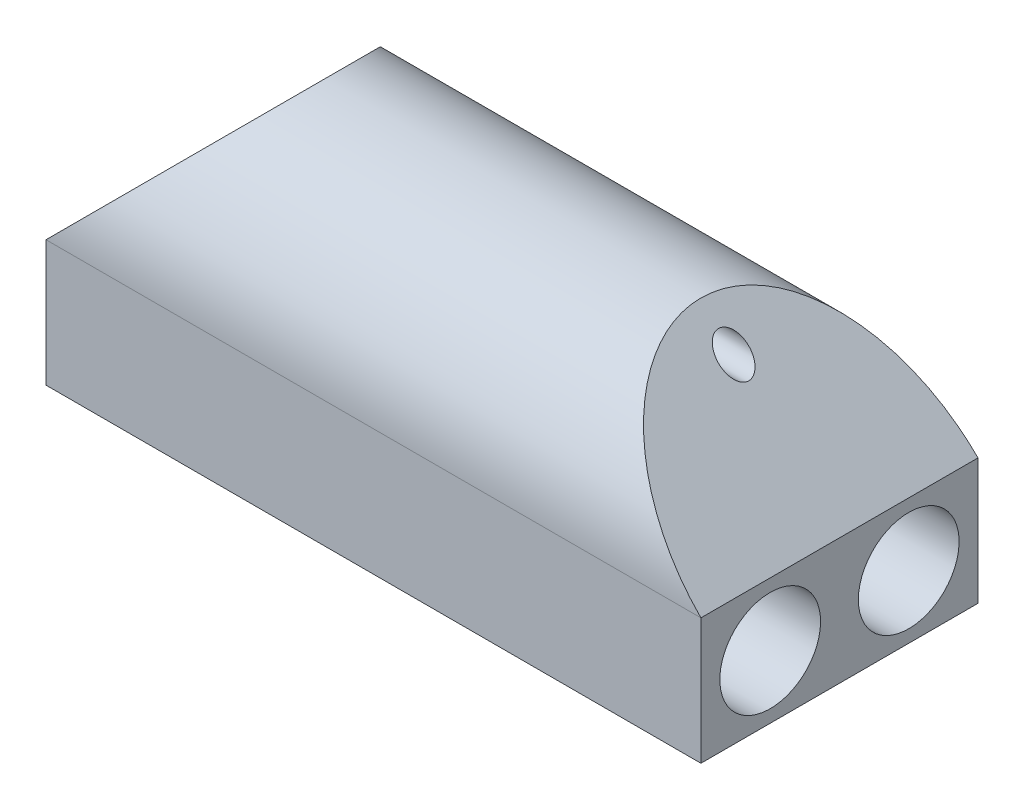
from build123d import *

# Parameters (mm, degrees)
SKETCH1_W              = 33.02
SKETCH1_H              = 13.97
DEPTH_A_DEPTH          = 6.35
ROUND_EXTRUDE_DEPTH    = 33.02
ANGLE_CUT_DEPTH        = 39.253150524
STRING_HOLE_R          = 0.762
STRING_HOLE_CUT_DEPTH  = 39.253150524
ELASTIC_HOLES_R        = 2.54
ELASTIC_HOLE_CUT_DEPTH = 39.253150524


with BuildPart() as part:
    # Sketch1 → depth a (new body)
    with BuildSketch(Plane(origin=(0, 0, 0), x_dir=(1, 0, 0), z_dir=(0, 1, 0))):
        with Locations((-16.51, 6.985)):
            Rectangle(SKETCH1_W, SKETCH1_H)
    extrude(amount=DEPTH_A_DEPTH)

    # Sketch4 → round extrude (add)
    with BuildSketch(Plane(origin=(0, 0, 0), x_dir=(0, 0, -1), z_dir=(1, 0, 0))):
        with BuildLine():
            Line((0, 6.35), (13.97, 6.35))
            ThreePointArc((13.97, 6.35), (6.985, 13.335), (0, 6.35))
        make_face()
    extrude(amount=-ROUND_EXTRUDE_DEPTH)

    # Sketch5 → angle cut (cut, through all)
    with BuildSketch(Plane.XY):
        Polygon((0, 6.35), (0, 13.335), (-6.985, 13.335), align=None)
        Polygon((-33.02, 6.35), (-33.02, 13.335), (-26.035, 13.335), align=None)
    extrude(amount=-ANGLE_CUT_DEPTH, mode=Mode.SUBTRACT)

    # string hole → string hole cut (cut, through all)
    with BuildSketch(Plane(origin=(0, 0, 0), x_dir=(0, 0, -1), z_dir=(1, 0, 0))):
        with Locations(Location((6.985, 11.684, 0), (0, 0, 270))):
            Circle(STRING_HOLE_R)
    extrude(amount=-STRING_HOLE_CUT_DEPTH, mode=Mode.SUBTRACT)

    # elastic holes → elastic hole cut (cut, through all)
    with BuildSketch(Plane(origin=(0, 0, 0), x_dir=(0, 0, -1), z_dir=(1, 0, 0))):
        with Locations((3.4925, 3.175)):
            Circle(ELASTIC_HOLES_R)
        with Locations(Location((10.4775, 3.175, 0), (0, 0, 180))):
            Circle(ELASTIC_HOLES_R)
    extrude(amount=-ELASTIC_HOLE_CUT_DEPTH, mode=Mode.SUBTRACT)


solid = part.part
